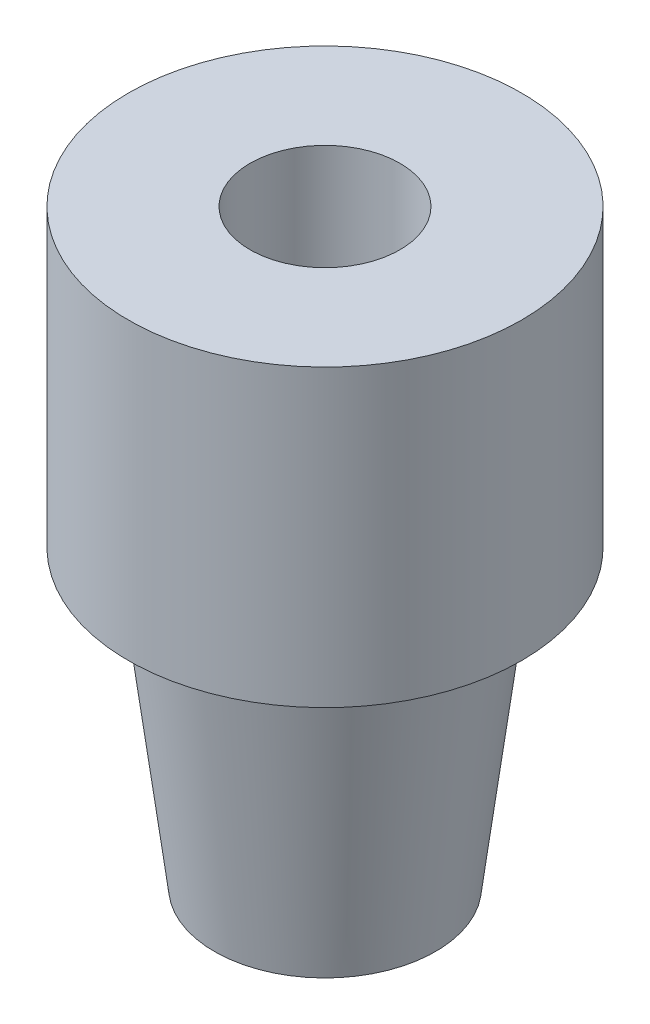
from build123d import *

# Parameters (mm, degrees)
CROQUIS2_R            = 3.05
CORTAR_EXTRUIR1_DEPTH = 10


with BuildPart() as part:
    # Croquis1 → Revolución1 (revolve)
    with BuildSketch(Plane.XY, mode=Mode.PRIVATE) as revoluci_n1_sk:
        Polygon((0, 8.266073618), (8, 8.266073618), (8, -3.733926382), (6, -3.733926382), (4.5, -15.733926382), (0, -15.733926382), align=None)
    revolve(revoluci_n1_sk.sketch.rotate(Axis((0, 12.501582414, 0), (0, -1, 0)), 180), axis=Axis((0, 12.501582414, 0), (0, -1, 0)))

    # Croquis2 → Cortar-Extruir1 (cut)
    with BuildSketch(Plane(origin=(0, 8.266073618, 0), x_dir=(1, 0, 0), z_dir=(0, 1, 0))):
        with Locations(Location((0, 0, 0), (0, 0, 180))):
            Circle(CROQUIS2_R)
    extrude(amount=-CORTAR_EXTRUIR1_DEPTH, mode=Mode.SUBTRACT)


solid = part.part
